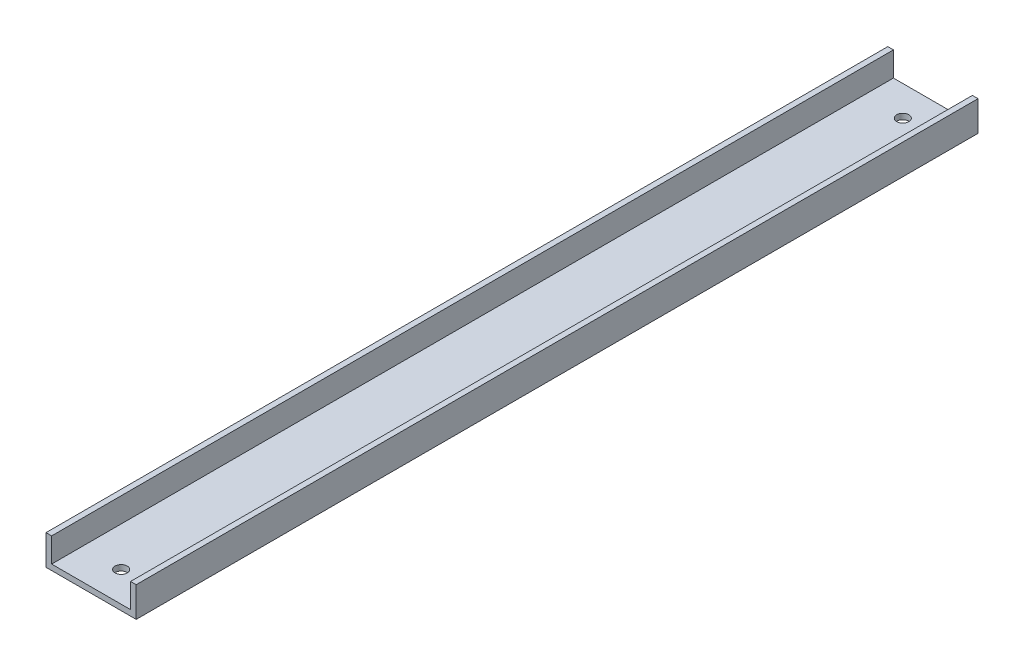
from build123d import *

# Parameters (mm, degrees)
BOSS_EXTRUDE1_DEPTH     = 177.8
F_1_4_20_TAPPED_HOLE1_D = 5.1054


with BuildPart() as part:
    # Sketch2 → Boss-Extrude1 (new, symmetric)
    with BuildSketch(Plane.XY):
        Polygon((-16.66875, 12.7), (-19.05, 12.7), (-19.05, 0), (19.05, 0), (19.05, 12.7), (16.66875, 12.7), (16.66875, 2.38125), (-16.66875, 2.38125), align=None)
    extrude(amount=BOSS_EXTRUDE1_DEPTH, both=True)

    # 1/4-20 Tapped Hole1 (through all)
    with Locations(Plane(origin=(0, 2.38125, 0), x_dir=(1, 0, 0), z_dir=(0, 1, 0))):
        with Locations((0, -165.1)):
            f_1_4_20_tapped_hole1 = Hole(F_1_4_20_TAPPED_HOLE1_D / 2)

    # Mirror1: 1/4-20 Tapped Hole1 across plane
    add(f_1_4_20_tapped_hole1.mirror(Plane.XY), mode=Mode.SUBTRACT)


solid = part.part
